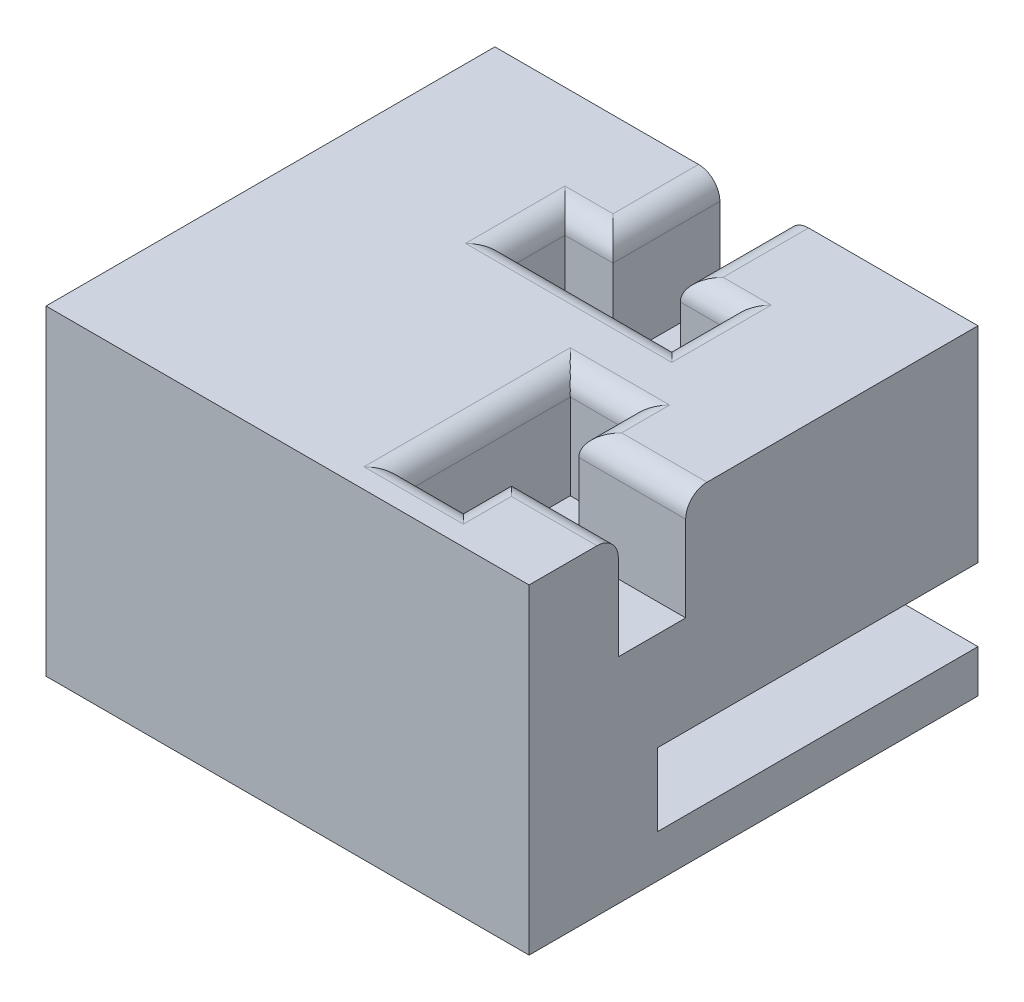
from build123d import *

# Parameters (mm, degrees)
SKETCH1_W           = 25
SKETCH1_H           = 21
BOSS_EXTRUDE1_DEPTH = 15
SKETCH2_W           = 15
SKETCH2_H           = 3.4
CUT_EXTRUDE1_DEPTH  = 22.6
CUT_EXTRUDE2_DEPTH  = 5
FILLET1_R           = 1
SKETCH4_W           = 2.4
SKETCH4_H           = 15
CUT_EXTRUDE4_DEPTH  = 64.025788373


with BuildPart() as part:
    # Sketch1 → Boss-Extrude1 (new body)
    with BuildSketch(Plane(origin=(0, 0, 0), x_dir=(1, 0, 0), z_dir=(0, 1, 0))):
        Rectangle(SKETCH1_W, SKETCH1_H)
    extrude(amount=BOSS_EXTRUDE1_DEPTH)

    # Sketch2 → Cut-Extrude1 (cut)
    with BuildSketch(Plane.ZY.offset(12.5)):
        with Locations((-3, 3.7)):
            Rectangle(SKETCH2_W, SKETCH2_H)
    extrude(amount=-CUT_EXTRUDE1_DEPTH, mode=Mode.SUBTRACT)

    # Sketch3 → Cut-Extrude2 (cut)
    with BuildSketch(Plane(origin=(0, 15, 0), x_dir=(1, 0, 0), z_dir=(0, 1, 0))):
        Polygon((-4.85, -0.925), (-4.85, -8.575), (-7.5, -8.575), (-7.5, -6.325), (-12.5, -6.325), (-12.5, -3.175), (-7.5, -3.175), (-7.5, -0.925), align=None)
        Polygon((-3.575, 10.5), (-3.575, 5.5), (-5.825, 5.5), (-5.825, 2.85), (1.825, 2.85), (1.825, 5.5), (-0.425, 5.5), (-0.425, 10.5), align=None)
    extrude(amount=-CUT_EXTRUDE2_DEPTH, mode=Mode.SUBTRACT)

    # Fillet1
    fillet1_edges = [part.edges().sort_by_distance(p)[0] for p in [
        (-6.175, 15, 0.925),
        (-7.5, 15, 2.05),
        (-10, 15, 3.175),
        (-10, 15, 6.325),
        (-7.5, 15, 7.45),
        (-6.175, 15, 8.575),
        (-4.85, 15, 4.75),
        (-3.575, 15, -8),
        (-4.7, 15, -5.5),
        (-5.825, 15, -4.175),
        (-2, 15, -2.85),
        (1.825, 15, -4.175),
        (0.7, 15, -5.5),
        (-0.425, 15, -8),
    ]]
    fillet(fillet1_edges, radius=FILLET1_R)


with BuildPart() as body_2:
    # Mirror2: mirrored copy
    add(part.part.mirror(Plane.ZY.offset(22.5)))

    # Sketch4 → Cut-Extrude4 (cut, through all)
    with BuildSketch(Plane(origin=(0, 0, -10.5), x_dir=(-1, 0, 0), z_dir=(0, 0, -1))):
        with Locations((56.3, 7.5)):
            Rectangle(SKETCH4_W, SKETCH4_H)
    extrude(amount=-CUT_EXTRUDE4_DEPTH, mode=Mode.SUBTRACT)


solid = body_2.part
